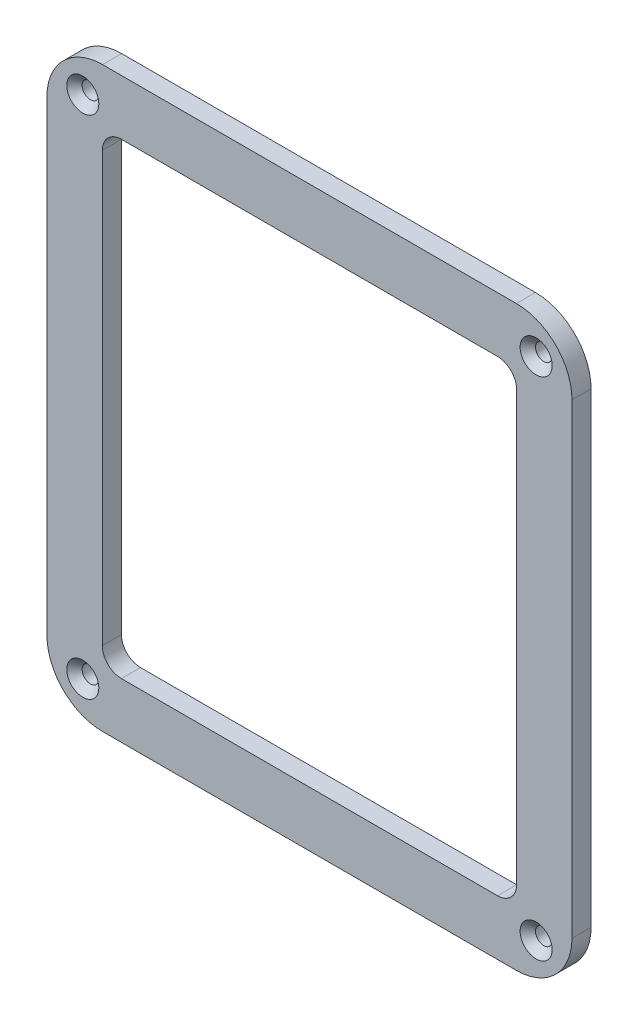
from build123d import *

# Parameters (mm, degrees)
SKETCH1_R                                            = 1.75
BOSS_EXTRUDE1_DEPTH                                  = 4
CSK_FOR_M3_HEX_SOCKET_COUNTERSUNK_CAP_SC_D           = 3.4
CSK_FOR_M3_HEX_SOCKET_COUNTERSUNK_CAP_SC_CSINK_D     = 6.72
CSK_FOR_M3_HEX_SOCKET_COUNTERSUNK_CAP_SC_CSINK_ANGLE = 90


with BuildPart() as part:
    # Sketch1 → Boss-Extrude1 (new body)
    with BuildSketch(Plane.XY):
        with BuildLine():
            Line((43.35, -60.5), (-43.35, -60.5))
            ThreePointArc((-43.35, -60.5), (-51.587794001, -57.087794001), (-55, -48.85))
            Line((-55, -48.85), (-55, 48.85))
            ThreePointArc((-55, 48.85), (-51.587794001, 57.087794001), (-43.35, 60.5))
            Line((-43.35, 60.5), (43.35, 60.5))
            ThreePointArc((43.35, 60.5), (51.587794001, 57.087794001), (55, 48.85))
            Line((55, 48.85), (55, -48.85))
            ThreePointArc((55, -48.85), (51.587794001, -57.087794001), (43.35, -60.5))
        make_face()
        with Locations((-47.488440649, 52.988440649)):
            Circle(SKETCH1_R, mode=Mode.SUBTRACT)
        with Locations(Location((47.488440649, 52.988440649, 0), (0, 0, 180))):
            Circle(SKETCH1_R, mode=Mode.SUBTRACT)
        with Locations((47.488440649, -52.988440649)):
            Circle(SKETCH1_R, mode=Mode.SUBTRACT)
        with Locations(Location((-47.488440649, -52.988440649, 0), (0, 0, 180))):
            Circle(SKETCH1_R, mode=Mode.SUBTRACT)
        with BuildLine():
            Line((39.4, -48.925), (-39.4, -48.925))
            ThreePointArc((-39.4, -48.925), (-42.228427125, -47.753427125), (-43.4, -44.925))
            Line((-43.4, -44.925), (-43.4, 44.925))
            ThreePointArc((-43.4, 44.925), (-42.228427125, 47.753427125), (-39.4, 48.925))
            Line((-39.4, 48.925), (39.4, 48.925))
            ThreePointArc((39.4, 48.925), (42.228427125, 47.753427125), (43.4, 44.925))
            Line((43.4, 44.925), (43.4, -44.925))
            ThreePointArc((43.4, -44.925), (42.228427125, -47.753427125), (39.4, -48.925))
        make_face(mode=Mode.SUBTRACT)
    extrude(amount=BOSS_EXTRUDE1_DEPTH)

    # CSK for M3 Hex Socket Countersunk Cap Screw1 (through all)
    with Locations(Plane.XY.offset(4)):
        with Locations((-47.488440649, -52.988440649), (47.488440649, -52.988440649), (47.488440649, 52.988440649), (-47.488440649, 52.988440649)):
            CounterSinkHole(CSK_FOR_M3_HEX_SOCKET_COUNTERSUNK_CAP_SC_D / 2, CSK_FOR_M3_HEX_SOCKET_COUNTERSUNK_CAP_SC_CSINK_D / 2, counter_sink_angle=CSK_FOR_M3_HEX_SOCKET_COUNTERSUNK_CAP_SC_CSINK_ANGLE)


solid = part.part
